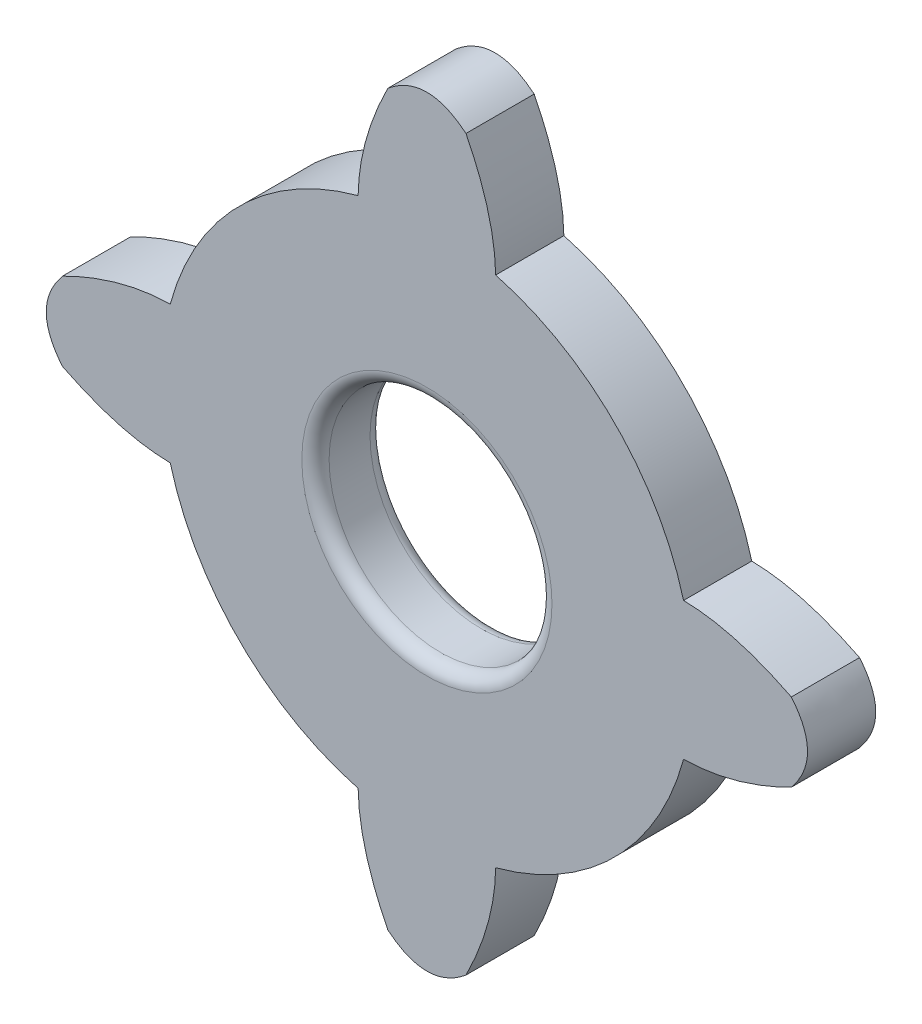
from build123d import *

# Parameters (mm, degrees)
SKETCH1_R           = 16.342033632
BOSS_EXTRUDE1_DEPTH = 10
FILLET1_R           = 2
FILLET2_R           = 2


with BuildPart() as part:
    # Sketch1 → Boss-Extrude1 (new body)
    with BuildSketch(Plane.XY):
        with BuildLine():
            ThreePointArc((-37.630023744, -10.082934473), (-27.54708927, -27.54708927), (-10.082934473, -37.630023744))
            add(Edge.make_bspline(
                [(-5.730379822, -53.435114302), (-9.976997746, -45.009715936), (-10.082934473, -37.630023744)],
                knots=[0, 0, 0, 1, 1, 1], degree=2))
            add(Edge.make_bspline(
                [(5.730379822, -53.435114302), (0, -58.17853574), (-5.730379822, -53.435114302)],
                knots=[0, 0, 0, 1, 1, 1], degree=2))
            add(Edge.make_bspline(
                [(5.730379822, -53.435114302), (9.976997746, -45.009715936), (10.082934473, -37.630023744)],
                knots=[0, 0, 0, 1, 1, 1], degree=2))
            ThreePointArc((10.082934473, -37.630023744), (27.54708927, -27.54708927), (37.630023744, -10.082934473))
            add(Edge.make_bspline(
                [(53.435114302, -5.730379822), (45.009715936, -9.976997746), (37.630023744, -10.082934473)],
                knots=[0, 0, 0, 1, 1, 1], degree=2))
            add(Edge.make_bspline(
                [(53.435114302, 5.730379822), (58.17853574, 0), (53.435114302, -5.730379822)],
                knots=[0, 0, 0, 1, 1, 1], degree=2))
            add(Edge.make_bspline(
                [(53.435114302, 5.730379822), (45.009715936, 9.976997746), (37.630023744, 10.082934473)],
                knots=[0, 0, 0, 1, 1, 1], degree=2))
            ThreePointArc((37.630023744, 10.082934473), (27.54708927, 27.54708927), (10.082934473, 37.630023744))
            add(Edge.make_bspline(
                [(5.730379822, 53.435114302), (9.976997746, 45.009715936), (10.082934473, 37.630023744)],
                knots=[0, 0, 0, 1, 1, 1], degree=2))
            add(Edge.make_bspline(
                [(-5.730379822, 53.435114302), (0, 58.17853574), (5.730379822, 53.435114302)],
                knots=[0, 0, 0, 1, 1, 1], degree=2))
            add(Edge.make_bspline(
                [(-5.730379822, 53.435114302), (-9.976997746, 45.009715936), (-10.082934473, 37.630023744)],
                knots=[0, 0, 0, 1, 1, 1], degree=2))
            ThreePointArc((-10.082934473, 37.630023744), (-27.54708927, 27.54708927), (-37.630023744, 10.082934473))
            add(Edge.make_bspline(
                [(-53.435114302, 5.730379822), (-45.009715936, 9.976997746), (-37.630023744, 10.082934473)],
                knots=[0, 0, 0, 1, 1, 1], degree=2))
            add(Edge.make_bspline(
                [(-53.435114302, -5.730379822), (-58.17853574, 0), (-53.435114302, 5.730379822)],
                knots=[0, 0, 0, 1, 1, 1], degree=2))
            add(Edge.make_bspline(
                [(-53.435114302, -5.730379822), (-45.009715936, -9.976997746), (-37.630023744, -10.082934473)],
                knots=[0, 0, 0, 1, 1, 1], degree=2))
        make_face()
        Circle(SKETCH1_R, mode=Mode.SUBTRACT)
    extrude(amount=BOSS_EXTRUDE1_DEPTH)

    # Fillet1
    fillet1_edges = [part.edges().sort_by_distance(p)[0] for p in [
        (-16.342033632, 0, 0),
    ]]
    fillet(fillet1_edges, radius=FILLET1_R)

    # Fillet2
    fillet2_edges = [part.edges().sort_by_distance(p)[0] for p in [
        (-16.342033632, 0, 10),
    ]]
    fillet(fillet2_edges, radius=FILLET2_R)


solid = part.part
